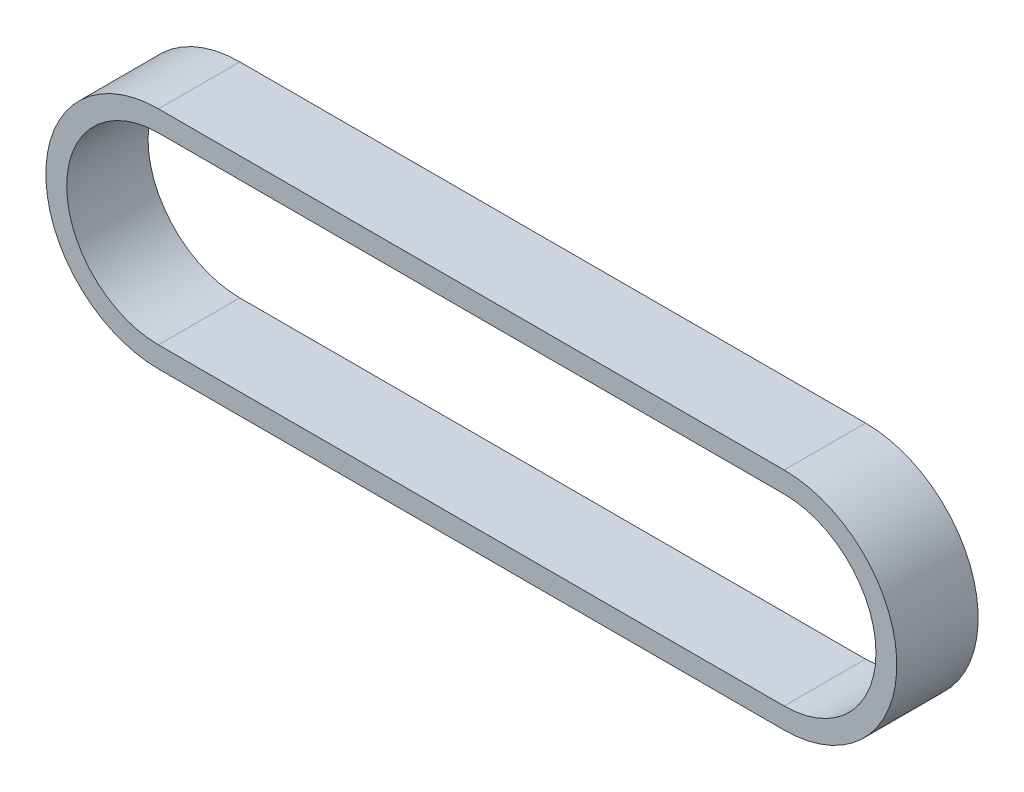
from build123d import *

# Parameters (mm, degrees)
EXTRUDE_THIN1_DEPTH = 19.5


with BuildPart() as part:
    # Sketch2 → Extrude-Thin1 (new, symmetric)
    with BuildSketch(Plane.XY):
        with BuildLine():
            Line((300.007608868, -53.957711417), (0.007611848, -53.999999464))
            ThreePointArc((0.007611848, -53.999999464), (-53.999999464, -0.007611848), (-0.007611848, 53.999999464))
            Line((-0.007611848, 53.999999464), (299.992385171, 54.04228751))
            ThreePointArc((299.992385171, 54.04228751), (353.999996483, 0.049899895), (300.007608868, -53.957711417))
        make_face()
        with BuildLine():
            Line((300.006199266, -43.957711516), (0.006202247, -43.999999563))
            ThreePointArc((0.006202247, -43.999999563), (-43.999999563, -0.006202247), (-0.006202247, 43.999999563))
            Line((-0.006202247, 43.999999563), (299.993794773, 44.04228761))
            ThreePointArc((299.993794773, 44.04228761), (343.999996582, 0.048490294), (300.006199266, -43.957711516))
        make_face(mode=Mode.SUBTRACT)
    extrude(amount=EXTRUDE_THIN1_DEPTH, both=True)


solid = part.part
